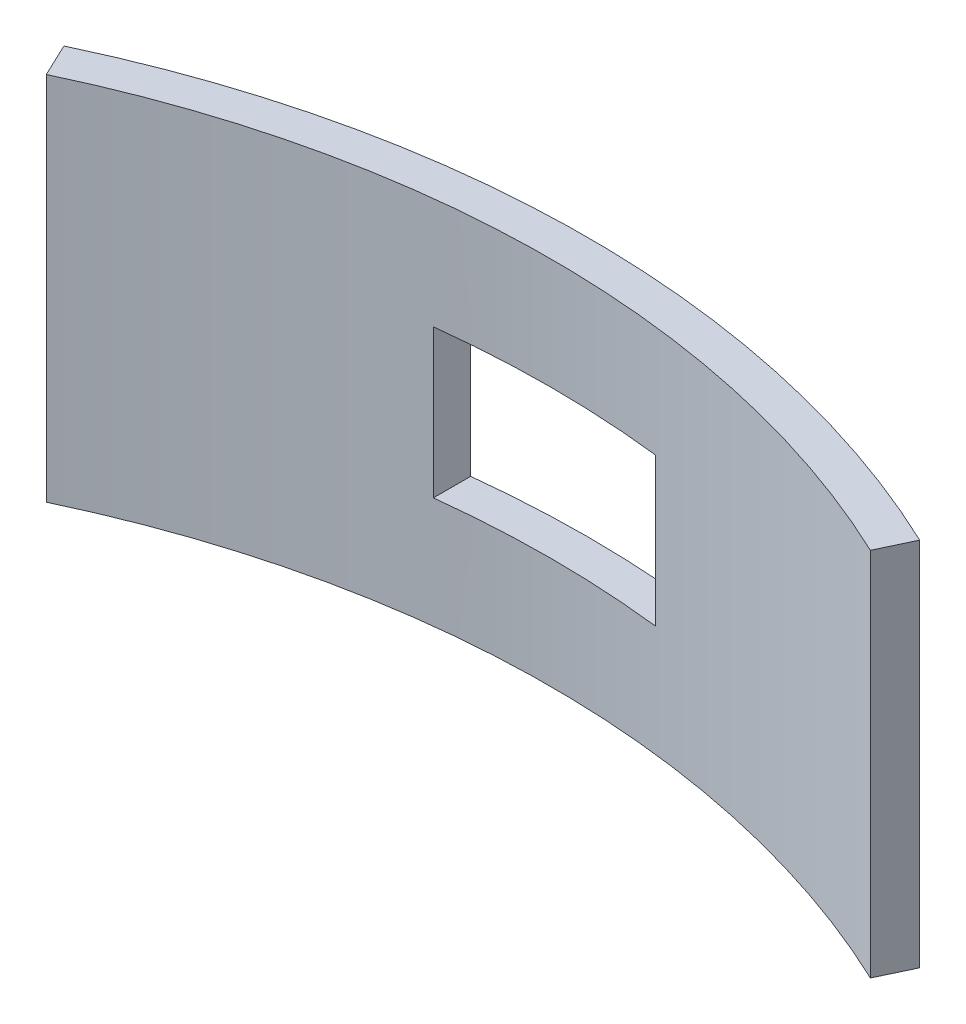
from build123d import *

# Parameters (mm, degrees)
BOSS_EXTRUDE1_DEPTH = 25.4
SKETCH2_W           = 15.24
SKETCH2_H           = 10.16
CUT_EXTRUDE1_DEPTH  = 144.272


with BuildPart() as part:
    # Sketch1 → Boss-Extrude1 (new body)
    with BuildSketch(Plane(origin=(0, 0, 0), x_dir=(1, 0, 0), z_dir=(0, 1, 0))):
        with BuildLine():
            Line((-29.342474553, 61.985769231), (-28.255716236, 59.69))
            ThreePointArc((-28.255716236, 59.69), (0, 66.04), (28.255716236, 59.69))
            Line((28.255716236, 59.69), (29.342474553, 61.985769231))
            ThreePointArc((29.342474553, 61.985769231), (0, 68.58), (-29.342474553, 61.985769231))
        make_face()
    extrude(amount=BOSS_EXTRUDE1_DEPTH)

    # Sketch2 → Cut-Extrude1 (cut)
    with BuildSketch(Plane.XY):
        with Locations((0, 12.7)):
            Rectangle(SKETCH2_W, SKETCH2_H)
    extrude(amount=-CUT_EXTRUDE1_DEPTH, mode=Mode.SUBTRACT)


solid = part.part
